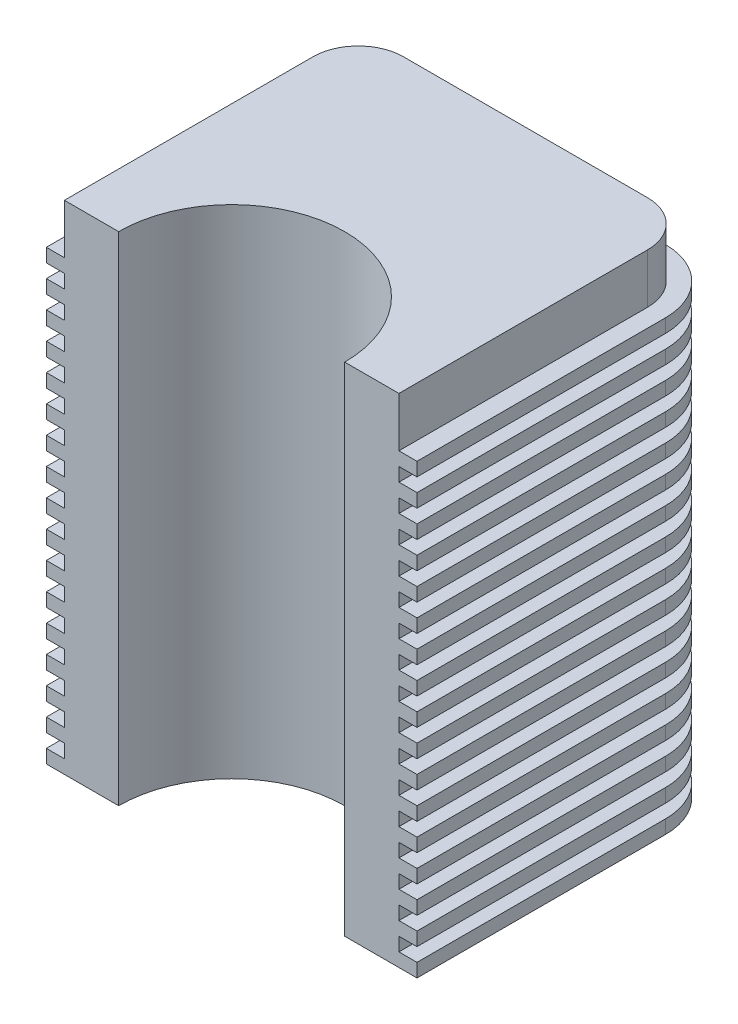
from build123d import *

# Parameters (mm, degrees)
BOSS_EXTRUDE1_DEPTH = 110
BOSS_EXTRUDE2_DEPTH = 3
LPATTERN1_COUNT     = 17
LPATTERN1_PITCH     = 6


with BuildPart() as part:
    # Sketch1 → Boss-Extrude1 (new body)
    with BuildSketch(Plane(origin=(0, 0, 0), x_dir=(1, 0, 0), z_dir=(0, 1, 0))):
        with BuildLine():
            Line((25, 0), (37, 0))
            Line((37, 0), (37, 55))
            ThreePointArc((37, 55), (34.071067812, 62.071067812), (27, 65))
            Line((27, 65), (-27, 65))
            ThreePointArc((-27, 65), (-34.071067812, 62.071067812), (-37, 55))
            Line((-37, 55), (-37, 0))
            Line((-37, 0), (-25, 0))
            ThreePointArc((-25, 0), (0, 25), (25, 0))
        make_face()
    extrude(amount=BOSS_EXTRUDE1_DEPTH)

    # Sketch3 → Boss-Extrude2 (add)
    with BuildSketch(Plane.XZ):
        with BuildLine():
            Line((-37, 0), (-41, 0))
            Line((-41, 0), (-41, -55))
            ThreePointArc((-41, -55), (-36.899494937, -64.899494937), (-27, -69))
            Line((-27, -69), (27, -69))
            ThreePointArc((27, -69), (36.899494937, -64.899494937), (41, -55))
            Line((41, -55), (41, 0))
            Line((41, 0), (37, 0))
            Line((37, 0), (37, -55))
            ThreePointArc((37, -55), (34.071067812, -62.071067812), (27, -65))
            Line((27, -65), (-27, -65))
            ThreePointArc((-27, -65), (-34.071067812, -62.071067812), (-37, -55))
            Line((-37, -55), (-37, 0))
        make_face()
    boss_extrude2 = extrude(amount=-BOSS_EXTRUDE2_DEPTH)

    # LPattern1: Boss-Extrude2 ×17
    with Locations(*[(0, i * LPATTERN1_PITCH, 0) for i in range(1, LPATTERN1_COUNT)]):
        add(boss_extrude2)


solid = part.part
